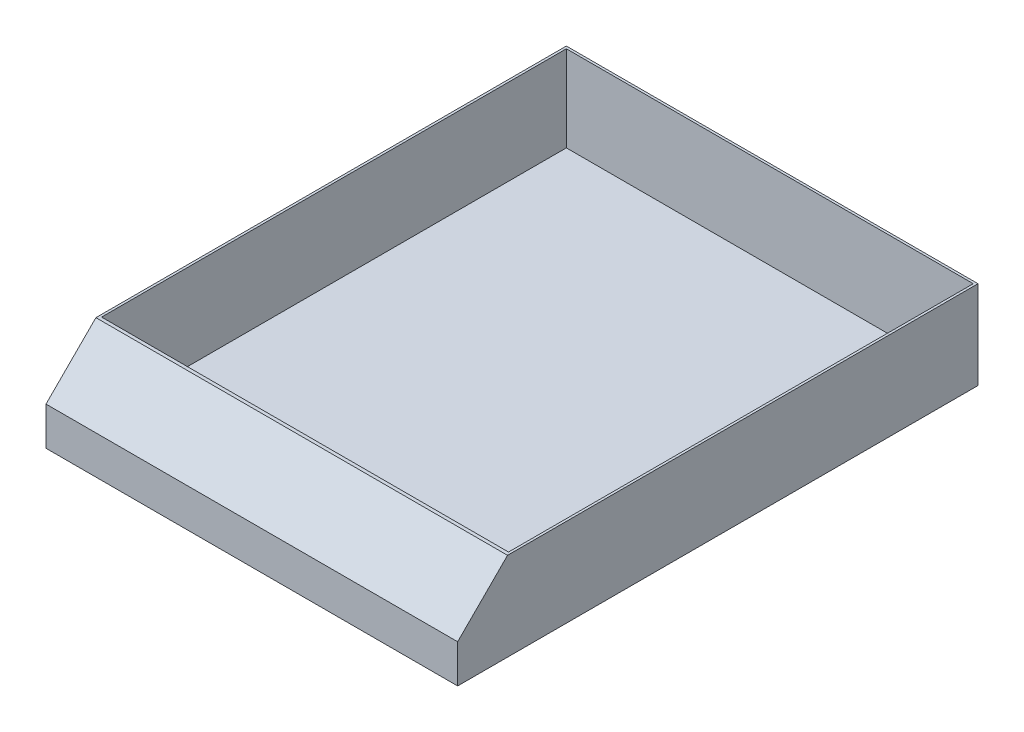
from build123d import *

# Parameters (mm, degrees)
BOSS_EXTRUDE1_DEPTH = 700
SHELL1_T            = -4


with BuildPart() as part:
    # Sketch2 → Boss-Extrude1 (new body)
    with BuildSketch(Plane(origin=(0, 0, 0), x_dir=(0, 0, -1), z_dir=(1, 0, 0))):
        Polygon((0, 0), (0, 65.147186258), (84.852813742, 150), (884.852813742, 150), (884.852813742, 0), align=None)
    extrude(amount=BOSS_EXTRUDE1_DEPTH)

    # Shell1
    shell1_openings = [part.faces().sort_by_distance(p)[0] for p in [
        (350, 150, -484.852813742),
    ]]
    offset(amount=SHELL1_T, openings=shell1_openings, kind=Kind.INTERSECTION)


solid = part.part
